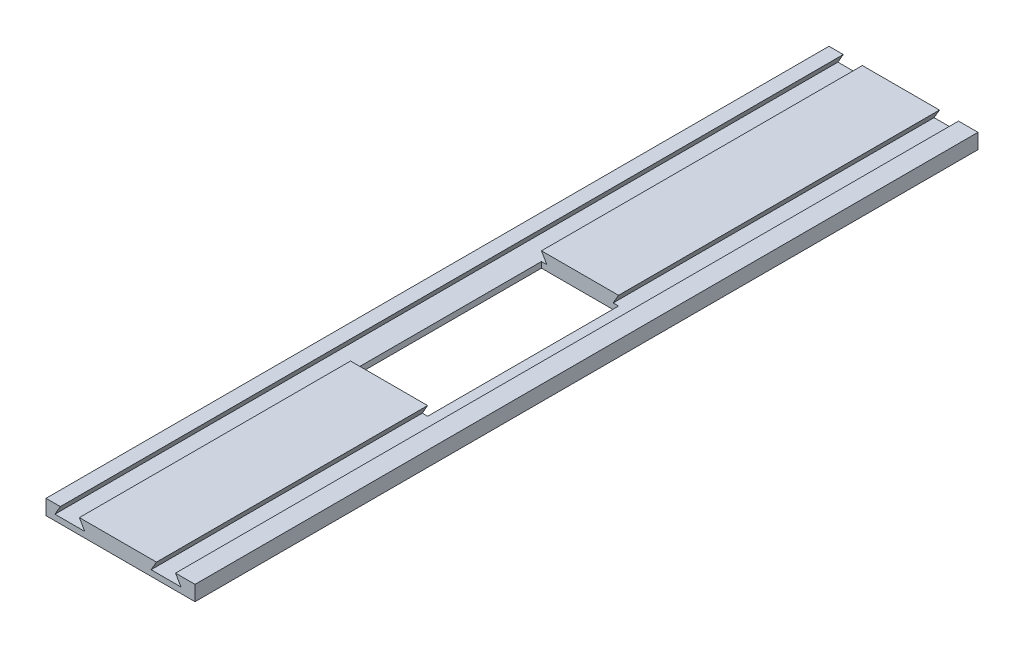
from build123d import *

# Parameters (mm, degrees)
BOSS_EXTRUDE1_DEPTH = 150
CUT_EXTRUDE4_REACH  = 1253.709
SKETCH5_W           = 12.933974596
SKETCH5_H           = 32.032750252
SKETCH7_W           = 25
SKETCH7_H           = 18.64
CUT_EXTRUDE5_DEPTH  = 1252.708964453


with BuildPart() as part:
    # Sketch1 → Boss-Extrude1 (new body)
    with BuildSketch(Plane.XY):
        Polygon((-1242.686178465, 885.422015852), (-1240.286178465, 885.422015852), (-1241.186178465, 883.863170125), (-1236.186178465, 883.863170125), (-1237.086178465, 885.422015852), (-1224.152203869, 885.422015852), (-1225.052203869, 883.863170125), (-1220.052203869, 883.863170125), (-1220.952203869, 885.422015852), (-1217.686178465, 885.422015852), (-1217.686178465, 882.893470027), (-1242.686178465, 882.893470027), align=None)
    extrude(amount=BOSS_EXTRUDE1_DEPTH)

    # Cut-Extrude4: up to this face of the body (flat: up to its plane)
    cut_extrude4_end = Plane(part.part.faces().sort_by_distance((-1230.186178465, 882.893470027, 75))[0])
    # Sketch5 → Cut-Extrude4 (cut, up to the picked face)
    with BuildSketch(Plane(origin=(0, 885.422015852, 0), x_dir=(1, 0, 0), z_dir=(0, 1, 0)), mode=Mode.PRIVATE) as cut_extrude4_sk1:
        with Locations((-1230.619191167, -69.852079699)):
            Rectangle(SKETCH5_W, SKETCH5_H)
    cut_extrude4_tool1 = split(extrude(cut_extrude4_sk1.sketch, amount=-CUT_EXTRUDE4_REACH, mode=Mode.PRIVATE), bisect_by=cut_extrude4_end, keep=Keep.BOTH, mode=Mode.PRIVATE)
    add(cut_extrude4_tool1.solids().sort_by(Axis((-1230.619191, 885.422016, 69.85208), (0, -1, 0)))[0], mode=Mode.SUBTRACT)

    # Sketch7 → Cut-Extrude5 (cut, through all)
    with BuildSketch(Plane(origin=(0, 882.893470027, 0), x_dir=(-1, 0, 0), z_dir=(0, -1, 0))):
        with Locations((1230.186178465, -140.68)):
            Rectangle(SKETCH7_W, SKETCH7_H)
    extrude(amount=-CUT_EXTRUDE5_DEPTH, mode=Mode.SUBTRACT)


solid = part.part
